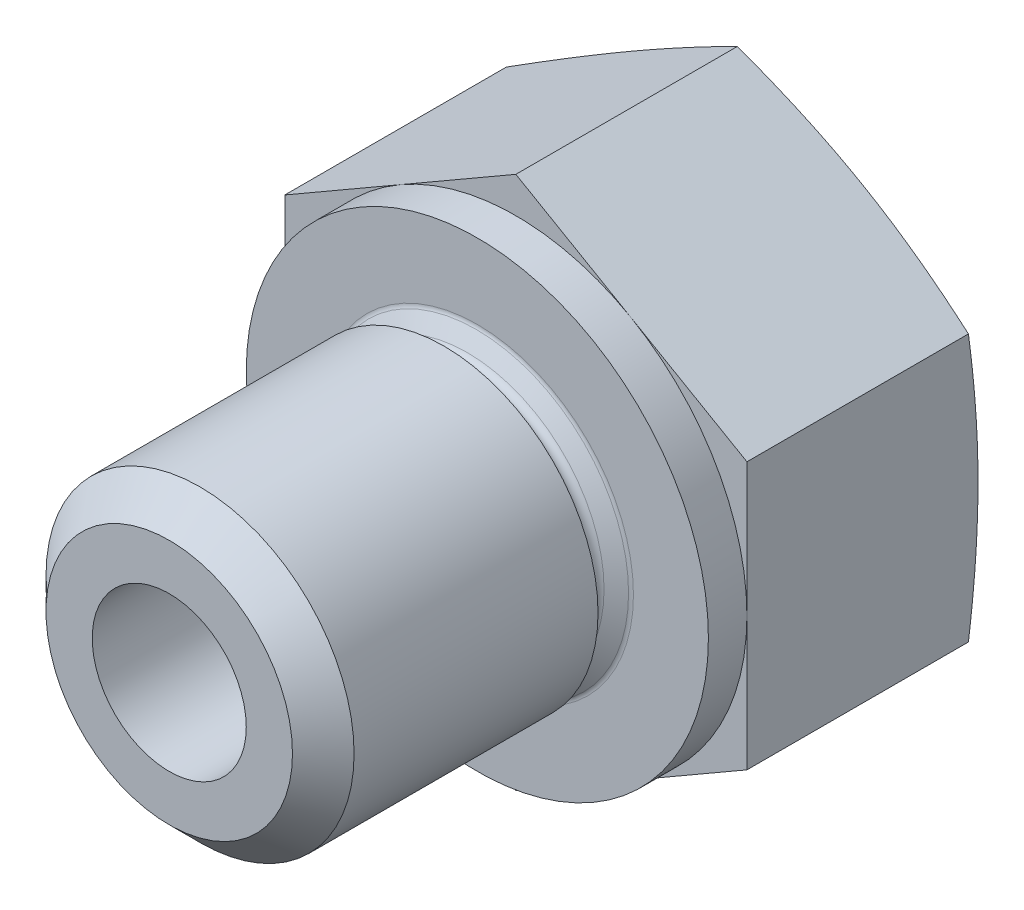
from build123d import *

# Parameters (mm, degrees)
VYSUNOUT1_DEPTH = 6
SKICA3_R        = 6
VYSUNOUT2_DEPTH = 1
SKICA4_R        = 4
VYSUNOUT3_DEPTH = 8
ZKOSIT1_SIZE    = 0.8
ZAOBLIT1_R      = 0.2
ZAOBLIT2_R      = 0.2


with BuildPart() as part:
    # Skica1 → Vysunout1 (new body)
    with BuildSketch(Plane.XY):
        Polygon((6, 3.464101615), (0, 6.92820323), (-6, 3.464101615), (-6, -3.464101615), (0, -6.92820323), (6, -3.464101615), align=None)
    extrude(amount=VYSUNOUT1_DEPTH)

    # Skica2 → Odebrat otočením1 (revolve, cut)
    with BuildSketch(Plane(origin=(0, 0, 0), x_dir=(1, 0, 0), z_dir=(0, 1, 0))):
        Polygon((6, 0), (28.392304845, 0), (28.392304845, -6), align=None)
    revolve(axis=Axis((0, 0, 0), (0, 0, 1)), mode=Mode.SUBTRACT)

    # Skica3 → Vysunout2 (add)
    with BuildSketch(Plane.XY.offset(6)):
        Circle(SKICA3_R)
    extrude(amount=VYSUNOUT2_DEPTH)

    # Skica4 → Vysunout3 (add)
    with BuildSketch(Plane.XY.offset(7)):
        Circle(SKICA4_R)
    extrude(amount=VYSUNOUT3_DEPTH)

    # Zkosit1
    zkosit1_edges = [part.edges().sort_by_distance(p)[0] for p in [
        (-4, 0, 15),
    ]]
    chamfer(zkosit1_edges, length=ZKOSIT1_SIZE)

    # Skica6 → Odebrat otočením2 (revolve, cut)
    with BuildSketch(Plane(origin=(0, 0, 0), x_dir=(1, 0, 0), z_dir=(0, 1, 0))):
        Polygon((0, -11.464101615), (2, -12), (2, -15), (0, -15), align=None)
    revolve(axis=Axis((0, 0, 15), (0, 0, -1)), mode=Mode.SUBTRACT)

    # Zaoblit1
    zaoblit1_edges = [part.edges().sort_by_distance(p)[0] for p in [
        (-2, 0, 12),
    ]]
    fillet(zaoblit1_edges, radius=ZAOBLIT1_R)

    # Skica7 → Odebrat otočením3 (revolve, cut)
    with BuildSketch(Plane(origin=(0, 0, 0), x_dir=(1, 0, 0), z_dir=(0, 1, 0)), mode=Mode.PRIVATE) as odebrat_oto_en_m3_sk:
        Polygon((4, -7), (3.25, -7.433012702), (4, -7.866025404), align=None)
    revolve(odebrat_oto_en_m3_sk.sketch.rotate(Axis((0, 0, 0), (0, 0, 1)), 180), axis=Axis((0, 0, 0), (0, 0, 1)), mode=Mode.SUBTRACT)

    # Zaoblit2
    zaoblit2_edges = [part.edges().sort_by_distance(p)[0] for p in [
        (3.25, 0, 7.433012702),
        (4, 0, 7),
    ]]
    fillet(zaoblit2_edges, radius=ZAOBLIT2_R)


solid = part.part
